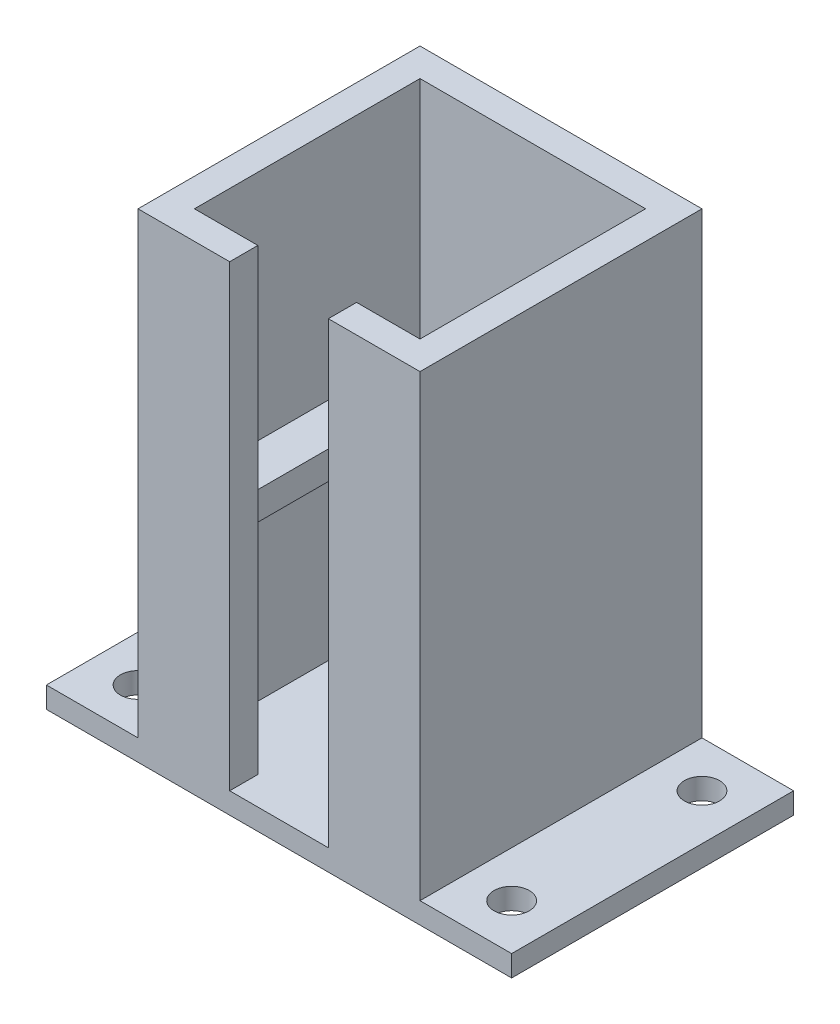
from build123d import *

# Parameters (mm, degrees)
SKETCH1_W           = 66
SKETCH1_H           = 40
SKETCH1_R           = 2.5
BOSS_EXTRUDE1_DEPTH = 3
BOSS_EXTRUDE2_DEPTH = 65
SKETCH3_W           = 6
SKETCH3_H           = 4
BOSS_EXTRUDE3_DEPTH = 32


with BuildPart() as part:
    # Sketch1 → Boss-Extrude1 (new body)
    with BuildSketch(Plane(origin=(0, 0, 0), x_dir=(1, 0, 0), z_dir=(0, 1, 0))):
        with Locations((-78.704067838, 45.994872636)):
            Rectangle(SKETCH1_W, SKETCH1_H)
        with Locations(Location((-105.204067838, 59.494872636, 0), (0, 0, 270))):
            Circle(SKETCH1_R, mode=Mode.SUBTRACT)
        with Locations(Location((-105.204067838, 32.494872636, 0), (0, 0, 270))):
            Circle(SKETCH1_R, mode=Mode.SUBTRACT)
        with Locations(Location((-52.204067838, 59.494872636, 0), (0, 0, 270))):
            Circle(SKETCH1_R, mode=Mode.SUBTRACT)
        with Locations(Location((-52.204067838, 32.494872636, 0), (0, 0, 270))):
            Circle(SKETCH1_R, mode=Mode.SUBTRACT)
    extrude(amount=BOSS_EXTRUDE1_DEPTH)

    # Sketch2 → Boss-Extrude2 (add)
    with BuildSketch(Plane(origin=(0, 3, 0), x_dir=(1, 0, 0), z_dir=(0, 1, 0))):
        Polygon((-98.704067838, 65.994872636), (-58.704067838, 65.994872636), (-58.704067838, 25.994872636), (-71.704067838, 25.994872636), (-71.704067838, 29.994872636), (-62.704067838, 29.994872636), (-62.704067838, 61.994872636), (-94.704067838, 61.994872636), (-94.704067838, 29.994872636), (-85.704067838, 29.994872636), (-85.704067838, 25.994872636), (-98.704067838, 25.994872636), align=None)
    extrude(amount=BOSS_EXTRUDE2_DEPTH)

    # Sketch3 → Boss-Extrude3 (add)
    with BuildSketch(Plane.XY.offset(-61.994872636)):
        with Locations((-91.704067838, 33)):
            Rectangle(SKETCH3_W, SKETCH3_H)
        with Locations((-65.704067838, 33)):
            Rectangle(SKETCH3_W, SKETCH3_H)
    extrude(amount=BOSS_EXTRUDE3_DEPTH)


solid = part.part
